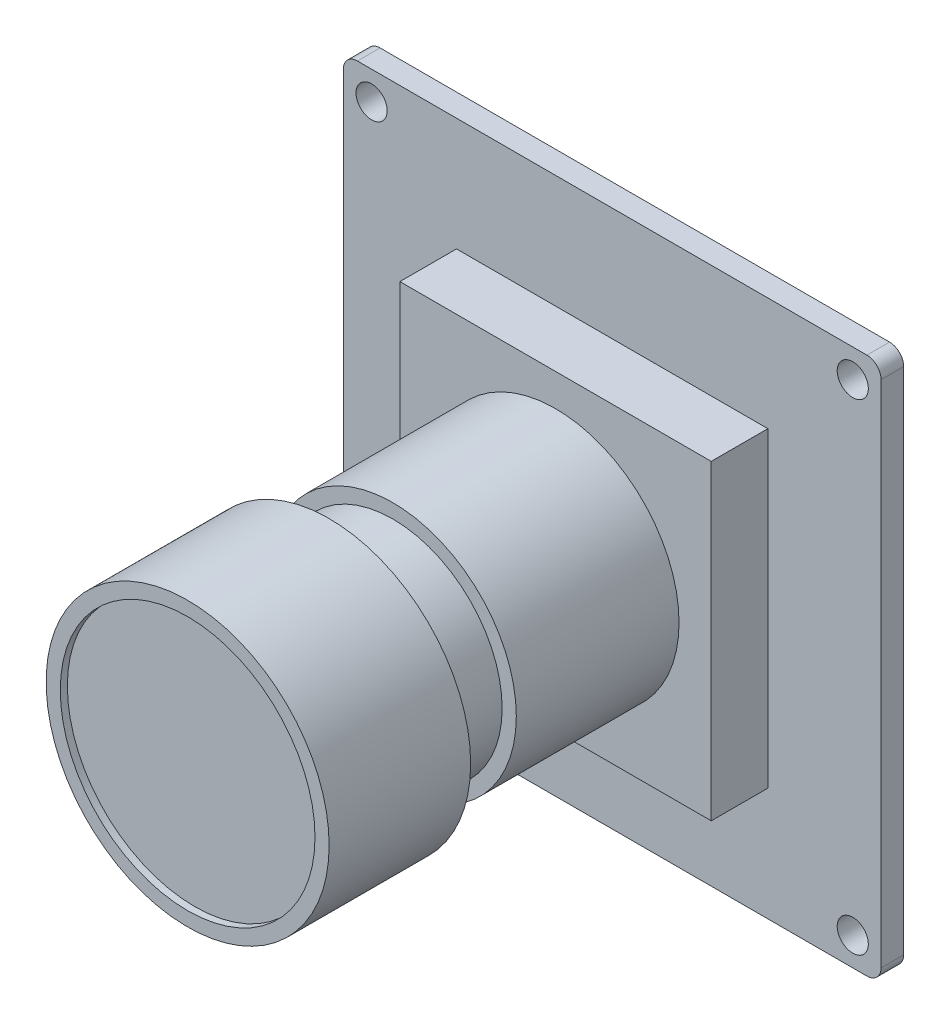
from build123d import *

# Parameters (mm, degrees)
SKETCH_1_W          = 38
SKETCH_1_H          = 38
EXTRUDE_1_DEPTH     = 1.6
SKETCH_2_R          = 1.1
CUT_EXTRUDE_1_DEPTH = 27.917652201
FILLET_1_R          = 1
SKETCH_3_W          = 22
SKETCH_3_H          = 22
EXTRUDE_2_DEPTH     = 4
SKETCH_4_R          = 8.725
EXTRUDE_3_DEPTH     = 15.5
SKETCH_5_R          = 7.725
EXTRUDE_4_DEPTH     = 30
SKETCH_6_R          = 10
EXTRUDE_5_DEPTH     = 10
SKETCH_7_R          = 9
CUT_EXTRUDE_3_DEPTH = 0.5


with BuildPart() as part:
    # 스케치1 → 보스-돌출1 (new body)
    with BuildSketch(Plane.XY):
        Rectangle(SKETCH_1_W, SKETCH_1_H)
    extrude(amount=EXTRUDE_1_DEPTH)

    # 스케치2 → 컷-돌출1 (cut, through all)
    with BuildSketch(Plane.XY.offset(1.6)):
        with Locations((-17, 17)):
            Circle(SKETCH_2_R)
        with Locations((17, -17)):
            Circle(SKETCH_2_R)
        with Locations((17, 17)):
            Circle(SKETCH_2_R)
        with Locations((-17, -17)):
            Circle(SKETCH_2_R)
    extrude(amount=-CUT_EXTRUDE_1_DEPTH, mode=Mode.SUBTRACT)

    # 필렛1
    fillet_1_edges = [part.edges().sort_by_distance(p)[0] for p in [
        (-19, 19, 0.8),
        (19, 19, 0.8),
        (19, -19, 0.8),
        (-19, -19, 0.8),
    ]]
    fillet(fillet_1_edges, radius=FILLET_1_R)

    # 스케치3 → 보스-돌출2 (add)
    with BuildSketch(Plane.XY.offset(1.6)):
        Rectangle(SKETCH_3_W, SKETCH_3_H)
    extrude(amount=EXTRUDE_2_DEPTH)

    # 스케치4 → 보스-돌출3 (add)
    with BuildSketch(Plane.XY.offset(1.6)):
        Circle(SKETCH_4_R)
    extrude(amount=EXTRUDE_3_DEPTH)

    # 스케치5 → 보스-돌출4 (add)
    with BuildSketch(Plane.XY.offset(1.6)):
        Circle(SKETCH_5_R)
    extrude(amount=EXTRUDE_4_DEPTH)

    # 스케치6 → 보스-돌출5 (add)
    with BuildSketch(Plane.XY.offset(31.6)):
        Circle(SKETCH_6_R)
    extrude(amount=-EXTRUDE_5_DEPTH)

    # 스케치7 → 컷-돌출3 (cut)
    with BuildSketch(Plane.XY.offset(31.6)):
        Circle(SKETCH_7_R)
    extrude(amount=-CUT_EXTRUDE_3_DEPTH, mode=Mode.SUBTRACT)


solid = part.part
